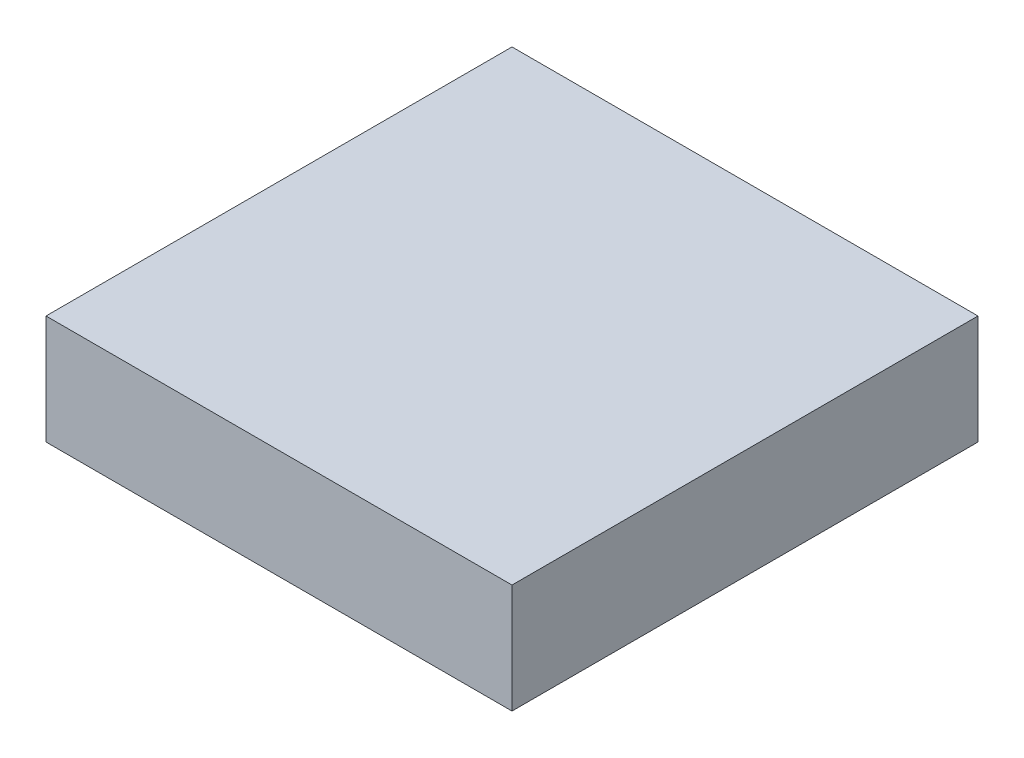
from build123d import *

# Parameters (mm, degrees)
SKETCH1_W           = 286
SKETCH1_H           = 286
BOSS_EXTRUDE1_DEPTH = 67


with BuildPart() as part:
    # Sketch1 → Boss-Extrude1 (new body)
    with BuildSketch(Plane(origin=(0, 0, 0), x_dir=(1, 0, 0), z_dir=(0, 1, 0))):
        Rectangle(SKETCH1_W, SKETCH1_H)
    extrude(amount=BOSS_EXTRUDE1_DEPTH)


solid = part.part
